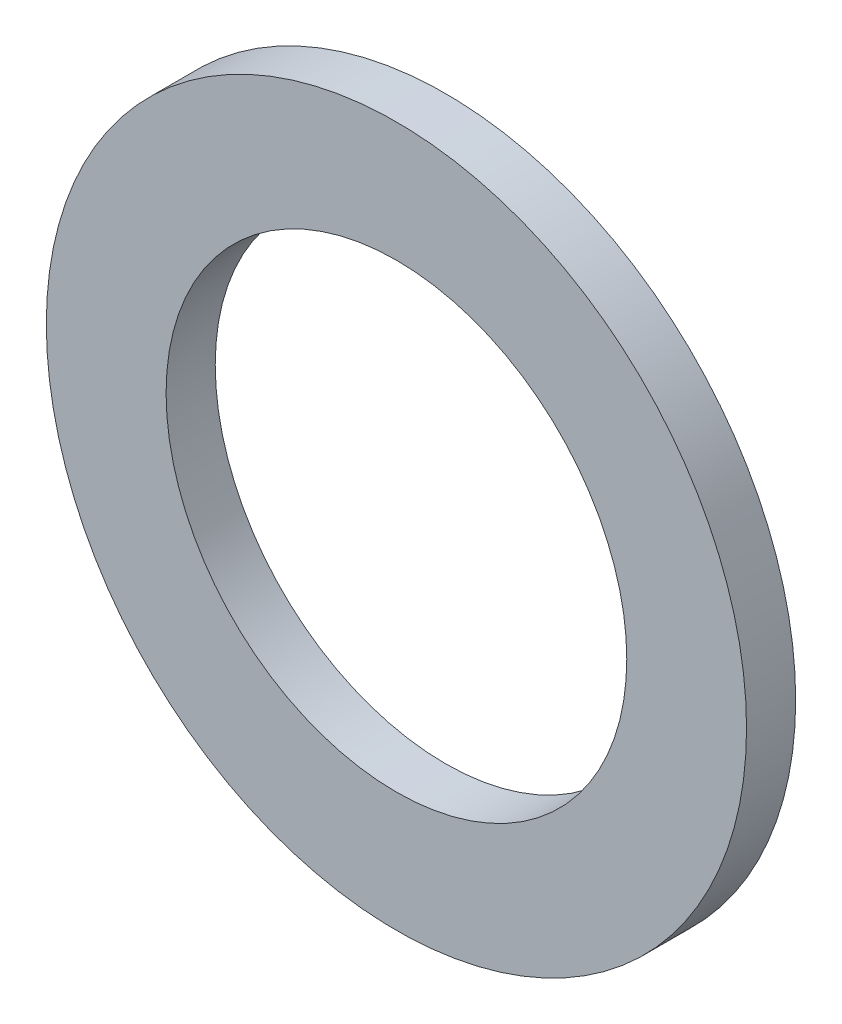
from build123d import *

# Parameters (mm, degrees)
SKETCH1_R           = 7.239
SKETCH1_R_2         = 4.7625
BOSS_EXTRUDE1_DEPTH = 1.016


with BuildPart() as part:
    # Sketch1 → Boss-Extrude1 (new body)
    with BuildSketch(Plane.XY):
        Circle(SKETCH1_R)
        Circle(SKETCH1_R_2, mode=Mode.SUBTRACT)
    extrude(amount=BOSS_EXTRUDE1_DEPTH)


solid = part.part
